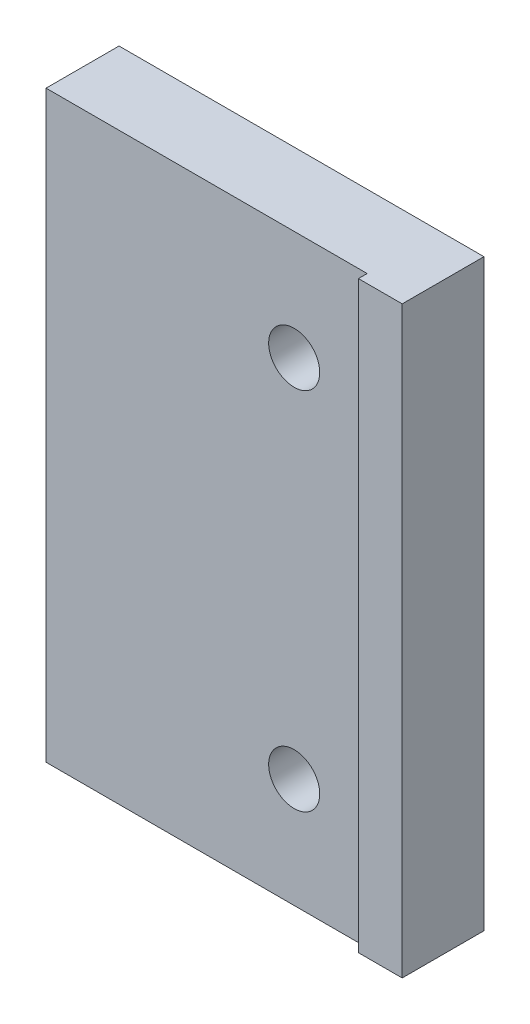
from build123d import *

# Parameters (mm, degrees)
SKETCH1_W           = 25
SKETCH1_H           = 40
SKETCH1_R           = 1.75
BOSS_EXTRUDE1_DEPTH = 5
SKETCH2_W           = 3
SKETCH2_H           = 40
BOSS_EXTRUDE2_DEPTH = 0.6


with BuildPart() as part:
    # Sketch1 → Boss-Extrude1 (new body)
    with BuildSketch(Plane.XY):
        with Locations((12.5, 20)):
            Rectangle(SKETCH1_W, SKETCH1_H)
        with Locations((17, 32.5)):
            Circle(SKETCH1_R, mode=Mode.SUBTRACT)
        with Locations((17, 7.5)):
            Circle(SKETCH1_R, mode=Mode.SUBTRACT)
    extrude(amount=BOSS_EXTRUDE1_DEPTH)

    # Sketch2 → Boss-Extrude2 (add)
    with BuildSketch(Plane.XY.offset(5)):
        with Locations((23.5, 20)):
            Rectangle(SKETCH2_W, SKETCH2_H)
    extrude(amount=BOSS_EXTRUDE2_DEPTH)


solid = part.part
